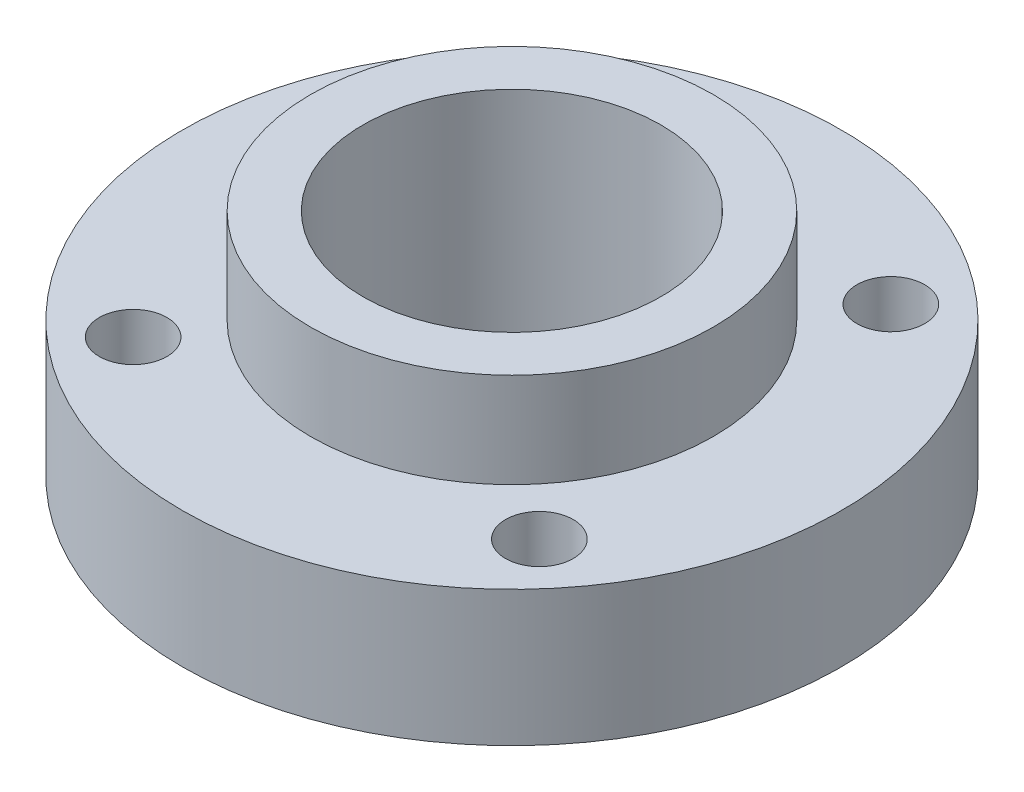
from build123d import *

# Parameters (mm, degrees)
SKETCH1_R            = 14.875
SKETCH1_R_2          = 11
BOSS_EXTRUDE13_DEPTH = 17
SKETCH1_14_R         = 24.34
SKETCH1_14_R_2       = 2.5
SKETCH1_14_R_3       = 14.875
BOSS_EXTRUDE14_DEPTH = 10
SKETCH1_16_R         = 11
SKETCH1_16_R_2       = 7.375
BOSS_EXTRUDE15_DEPTH = 1


with BuildPart() as part:
    # Sketch1 → Boss-Extrude13 (new body)
    with BuildSketch(Plane(origin=(0, 0, 0), x_dir=(1, 0, 0), z_dir=(0, 1, 0))):
        with Locations((-14.907558872, 21.380040763)):
            Circle(SKETCH1_R)
        with Locations((-14.907558872, 21.380040763)):
            Circle(SKETCH1_R_2, mode=Mode.SUBTRACT)
    extrude(amount=BOSS_EXTRUDE13_DEPTH)

    # Sketch1<14> → Boss-Extrude14 (add)
    with BuildSketch(Plane(origin=(0, 0, 0), x_dir=(1, 0, 0), z_dir=(0, 1, 0))):
        with Locations((-14.907558872, 21.380040763)):
            Circle(SKETCH1_14_R)
        with Locations((-27.824633533, 6.320997559)):
            Circle(SKETCH1_14_R_2, mode=Mode.SUBTRACT)
        with Locations((0.098010813, 8.400885227)):
            Circle(SKETCH1_14_R_2, mode=Mode.SUBTRACT)
        with Locations((-29.946083972, 34.320997559)):
            Circle(SKETCH1_14_R_2, mode=Mode.SUBTRACT)
        with Locations((-14.907558872, 21.380040763)):
            Circle(SKETCH1_14_R_3, mode=Mode.SUBTRACT)
        with Locations((-1.946083972, 36.400885227)):
            Circle(SKETCH1_14_R_2, mode=Mode.SUBTRACT)
    extrude(amount=BOSS_EXTRUDE14_DEPTH)

    # Sketch1<16> → Boss-Extrude15 (add)
    with BuildSketch(Plane(origin=(0, 0, 0), x_dir=(1, 0, 0), z_dir=(0, 1, 0))):
        with Locations((-14.907558872, 21.380040763)):
            Circle(SKETCH1_16_R)
        with Locations((-14.907558872, 21.380040763)):
            Circle(SKETCH1_16_R_2, mode=Mode.SUBTRACT)
    extrude(amount=BOSS_EXTRUDE15_DEPTH)


solid = part.part
